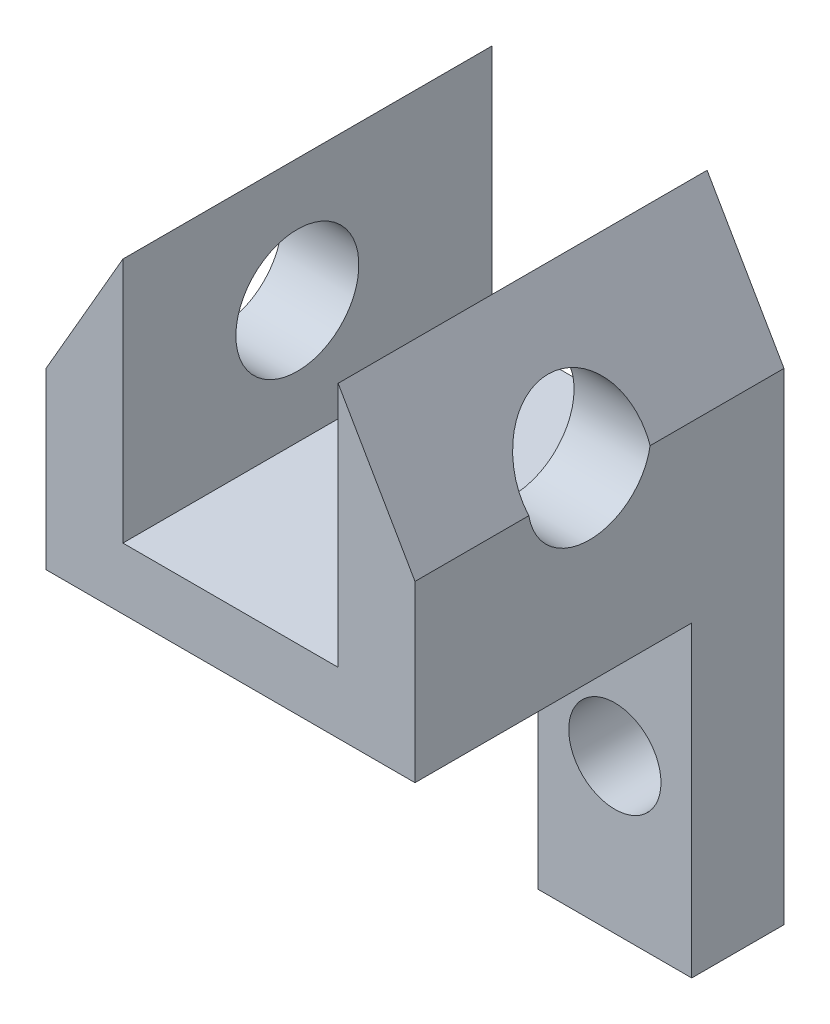
from build123d import *

# Parameters (mm, degrees)
SKETCH1_W                 = 12
SKETCH1_H                 = 12
BOSS_EXTRUDE1_DEPTH       = 2
SKETCH2_W                 = 2.5
SKETCH2_H                 = 12
BOSS_EXTRUDE2_DEPTH       = 8
CUT_EXTRUDE1_DEPTH        = 17.733200531
CUT_EXTRUDE2_DEPTH        = 16.041608956
CUT_EXTRUDE2_DEPTH_BACK   = 16.041608956
SKETCH4_R                 = 2
SKETCH6_W                 = 5
SKETCH6_H                 = 3
BOSS_EXTRUDE3_DEPTH       = 10
F_3_0MM_DOWEL_HOLE1_D     = 3
F_3_0MM_DOWEL_HOLE1_DEPTH = 3
F_3_0MM_DOWEL_HOLE1_TIP   = 0.901290929


with BuildPart() as part:
    # Sketch1 → Boss-Extrude1 (new body)
    with BuildSketch(Plane(origin=(0, 0, 0), x_dir=(1, 0, 0), z_dir=(0, 1, 0))):
        Rectangle(SKETCH1_W, SKETCH1_H)
    extrude(amount=BOSS_EXTRUDE1_DEPTH)

    # Sketch2 → Boss-Extrude2 (add)
    with BuildSketch(Plane(origin=(0, 2, 0), x_dir=(1, 0, 0), z_dir=(0, 1, 0))):
        with Locations((-4.75, 0)):
            Rectangle(SKETCH2_W, SKETCH2_H)
        with Locations((4.75, 0)):
            Rectangle(SKETCH2_W, SKETCH2_H)
    extrude(amount=BOSS_EXTRUDE2_DEPTH)

    # Sketch5 → Cut-Extrude1 (cut, through all)
    with BuildSketch(Plane.XY.offset(6)):
        Polygon((-3.5, 10), (-6, 5.669872981), (-6, 10), align=None)
        Polygon((3.5, 10), (6, 5.669872981), (6, 10), align=None)
    extrude(amount=-CUT_EXTRUDE1_DEPTH, mode=Mode.SUBTRACT)

    # Sketch4 → Cut-Extrude2 (cut, two sides: drawn at the far end of the back side and taken through both)
    with BuildSketch(Plane.ZY.offset(-3.5).offset(-CUT_EXTRUDE2_DEPTH_BACK)):
        with Locations((0.326138493, 6)):
            Circle(SKETCH4_R)
    extrude(amount=CUT_EXTRUDE2_DEPTH + CUT_EXTRUDE2_DEPTH_BACK, mode=Mode.SUBTRACT)

    # Sketch6 → Boss-Extrude3 (add)
    with BuildSketch(Plane.XZ):
        with Locations((3.5, -4.5)):
            Rectangle(SKETCH6_W, SKETCH6_H)
    extrude(amount=BOSS_EXTRUDE3_DEPTH)

    # Ø3.0mm Dowel Hole1
    with Locations(Plane.XY.offset(-3)):
        with Locations((3.5, -5)):
            Hole(F_3_0MM_DOWEL_HOLE1_D / 2, depth=F_3_0MM_DOWEL_HOLE1_DEPTH)
            with Locations((0, 0, -(F_3_0MM_DOWEL_HOLE1_DEPTH + F_3_0MM_DOWEL_HOLE1_TIP / 2))):  # 118° drill point
                Cone(0, F_3_0MM_DOWEL_HOLE1_D / 2, F_3_0MM_DOWEL_HOLE1_TIP, mode=Mode.SUBTRACT)


solid = part.part
